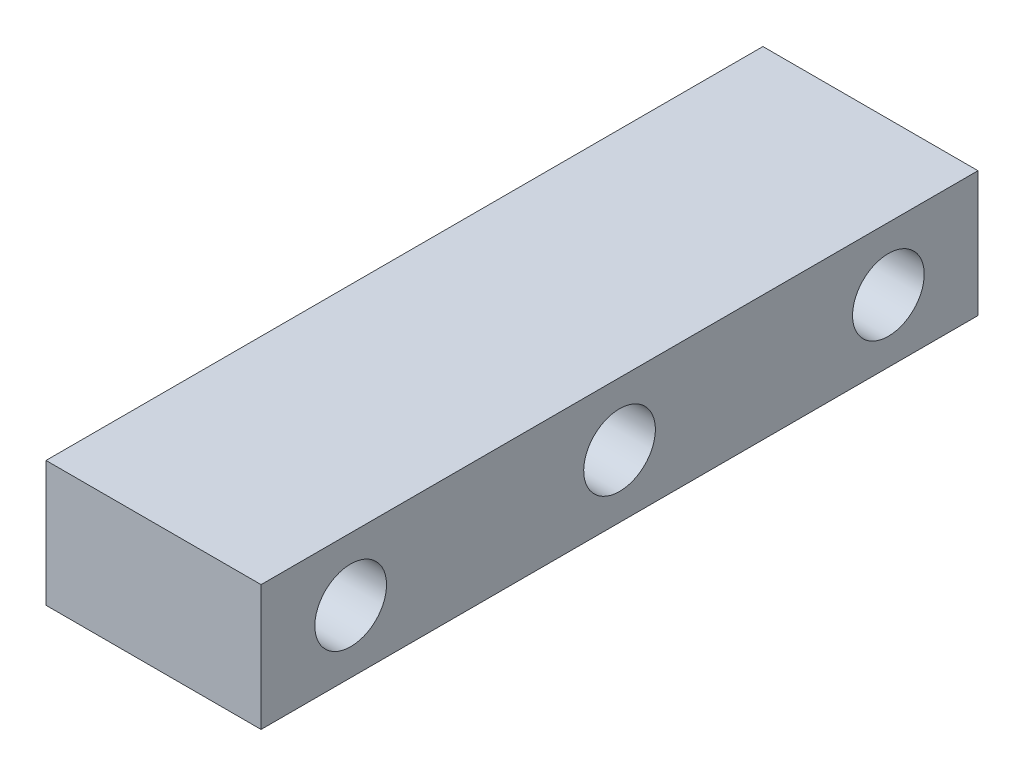
from build123d import *

# Parameters (mm, degrees)
SKETCH_1_W          = 24
SKETCH_1_H          = 14
EXTRUDE_1_DEPTH     = 90
SKETCH_2_R          = 4
CUT_EXTRUDE_1_DEPTH = 90
SKETCH_3_W          = 5
SKETCH_3_H          = 14
CUT_EXTRUDE_2_DEPTH = 95.191294715


with BuildPart() as part:
    # 草图1 → 拉伸1 (new body)
    with BuildSketch(Plane.XY):
        with Locations((12, -7)):
            Rectangle(SKETCH_1_W, SKETCH_1_H)
    extrude(amount=EXTRUDE_1_DEPTH)

    # 草图2 → 切除-拉伸1 (cut)
    with BuildSketch(Plane.ZY):
        with Locations(Location((15, -7, 0), (0, 0, 270))):
            Circle(SKETCH_2_R)
        with Locations(Location((45, -7, 0), (0, 0, 270))):
            Circle(SKETCH_2_R)
        with Locations(Location((75, -7, 0), (0, 0, 270))):
            Circle(SKETCH_2_R)
    extrude(amount=-CUT_EXTRUDE_1_DEPTH, mode=Mode.SUBTRACT)

    # 草图3 → 切除-拉伸2 (cut, through all)
    with BuildSketch(Plane(origin=(24, 0, 0), x_dir=(0, 0, -1), z_dir=(1, 0, 0))):
        with Locations((-87.5, -7)):
            Rectangle(SKETCH_3_W, SKETCH_3_H)
        with Locations((-2.5, -7)):
            Rectangle(SKETCH_3_W, SKETCH_3_H)
    extrude(amount=-CUT_EXTRUDE_2_DEPTH, mode=Mode.SUBTRACT)


solid = part.part
